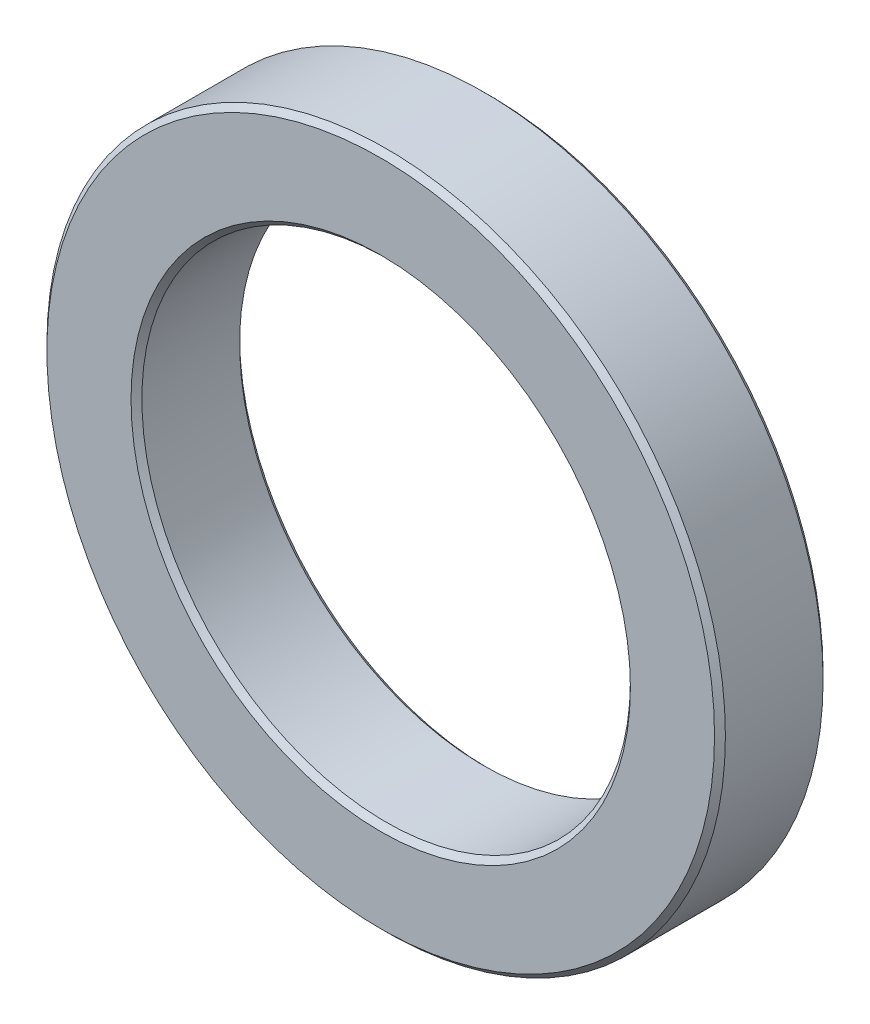
from build123d import *

# Parameters (mm, degrees)
SKETCH_1_R      = 62.5
SKETCH_1_R_2    = 45
EXTRUDE_1_DEPTH = 10
CHAMFER_1_SIZE  = 1


with BuildPart() as part:
    # 草图1 → 凸台-拉伸1 (new, symmetric)
    with BuildSketch(Plane.XY):
        Circle(SKETCH_1_R)
        Circle(SKETCH_1_R_2, mode=Mode.SUBTRACT)
    extrude(amount=EXTRUDE_1_DEPTH, both=True)

    # 倒角1
    chamfer_1_edges = [part.edges().sort_by_distance(p)[0] for p in [
        (-62.5, 0, -10),
        (-62.5, 0, 10),
        (-45, 0, -10),
        (-45, 0, 10),
    ]]
    chamfer(chamfer_1_edges, length=CHAMFER_1_SIZE)


solid = part.part
